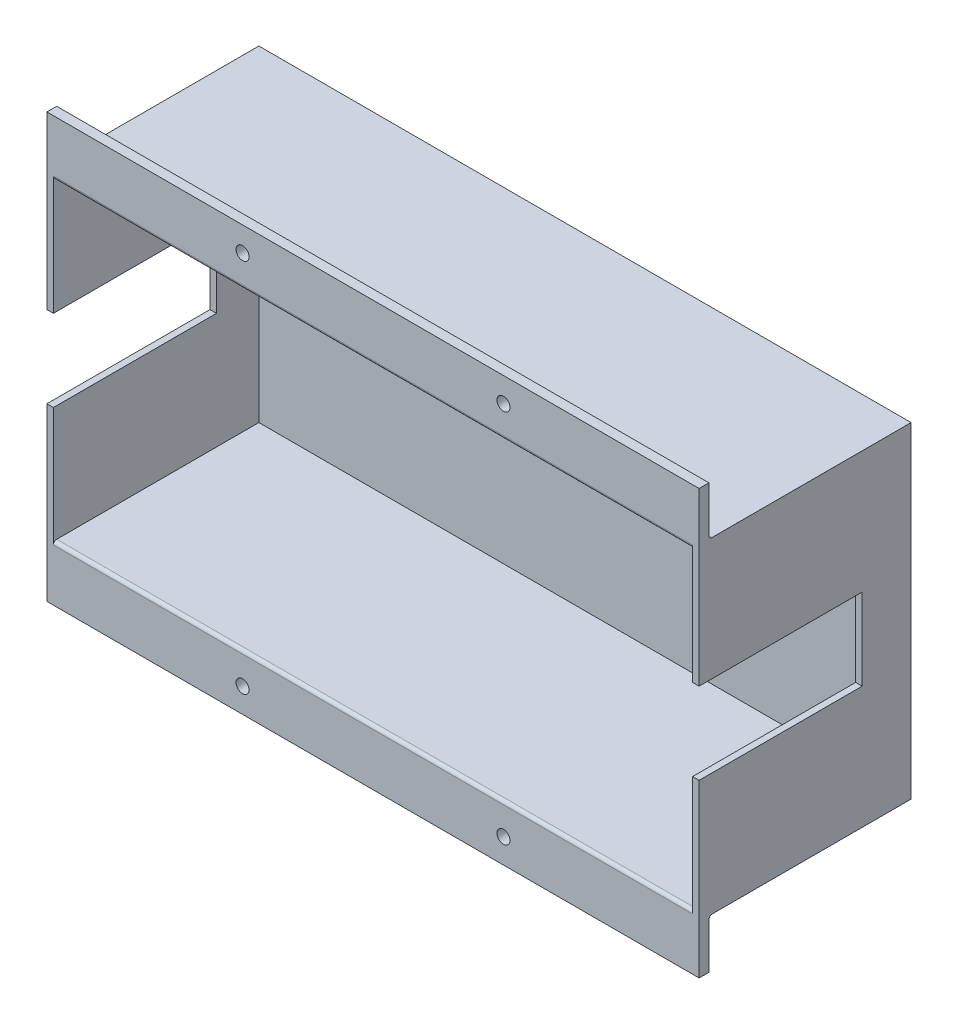
from build123d import *

# Parameters (mm, degrees)
SKETCH_1_W             = 200
SKETCH_1_H             = 100
EXTRUDE_1_DEPTH        = 2
SKETCH_2_W             = 200
SKETCH_2_H             = 100
SKETCH_2_W_2           = 196
SKETCH_2_H_2           = 96
EXTRUDE_2_DEPTH        = 63
SKETCH_3_W             = 7
SKETCH_3_H             = 18
CUT_EXTRUDE_1_DEPTH    = 63
SKETCH_4_W             = 200
SKETCH_4_H             = 15
EXTRUDE_3_DEPTH        = 3
EXTRUDE_4_DEPTH        = 5
PATTERN_LINEAR_1_COUNT = 2
PATTERN_LINEAR_1_PITCH = 80
PATTERN_LINEAR_2_COUNT = 2
PATTERN_LINEAR_2_PITCH = 80
SKETCH_6_R             = 2
CUT_EXTRUDE_2_DEPTH    = 5
FILLET_1_R             = 1
SKETCH_7_W             = 50
SKETCH_7_H             = 25
CUT_EXTRUDE_3_DEPTH    = 281


with BuildPart() as part:
    # 草图1 → 凸台-拉伸1 (new body)
    with BuildSketch(Plane.XY):
        Rectangle(SKETCH_1_W, SKETCH_1_H)
    extrude(amount=EXTRUDE_1_DEPTH)

    # 草图2 → 凸台-拉伸2 (add)
    with BuildSketch(Plane.XY.offset(2)):
        Rectangle(SKETCH_2_W, SKETCH_2_H)
        Rectangle(SKETCH_2_W_2, SKETCH_2_H_2, mode=Mode.SUBTRACT)
    extrude(amount=EXTRUDE_2_DEPTH)

    # 草图3 → 切除-拉伸1 (cut)
    with BuildSketch(Plane(origin=(0, 0, 0), x_dir=(-1, 0, 0), z_dir=(0, 0, -1))):
        with Locations((12.5, 0)):
            Rectangle(SKETCH_3_W, SKETCH_3_H)
        with Locations((-12.5, 0)):
            Rectangle(SKETCH_3_W, SKETCH_3_H)
    extrude(amount=-CUT_EXTRUDE_1_DEPTH, mode=Mode.SUBTRACT)

    # 草图4 → 凸台-拉伸3 (add)
    with BuildSketch(Plane.XY.offset(65)):
        with Locations((0, 57.5)):
            Rectangle(SKETCH_4_W, SKETCH_4_H)
        with Locations((0, -57.5)):
            Rectangle(SKETCH_4_W, SKETCH_4_H)
    extrude(amount=-EXTRUDE_3_DEPTH)

    # 草图5 → 凸台-拉伸4 (add)
    with BuildSketch(Plane(origin=(0, 0, 0), x_dir=(0, 0, -1), z_dir=(1, 0, 0))):
        Polygon((-62, 60), (-52, 50), (-62, 50), align=None)
        Polygon((-52, -50), (-62, -50), (-62, -60), align=None)
    extrude_4 = extrude(amount=EXTRUDE_4_DEPTH)

    # 阵列(线性)1: 凸台-拉伸4 ×2
    with Locations(*[(-i * PATTERN_LINEAR_1_PITCH, 0, 0) for i in range(1, PATTERN_LINEAR_1_COUNT)]):
        add(extrude_4)

    # 阵列(线性)2: 凸台-拉伸4 ×2
    with Locations(*[(i * PATTERN_LINEAR_2_PITCH, 0, 0) for i in range(1, PATTERN_LINEAR_2_COUNT)]):
        add(extrude_4)

    # 草图6 → 切除-拉伸2 (cut)
    with BuildSketch(Plane(origin=(0, 0, 62), x_dir=(-1, 0, 0), z_dir=(0, 0, -1))):
        with Locations((-40, -57.5)):
            Circle(SKETCH_6_R)
        with Locations(Location((40, -57.5, 0), (0, 0, 180))):
            Circle(SKETCH_6_R)
        with Locations((40, 57.5)):
            Circle(SKETCH_6_R)
        with Locations(Location((-40, 57.5, 0), (0, 0, 180))):
            Circle(SKETCH_6_R)
    extrude(amount=-CUT_EXTRUDE_2_DEPTH, mode=Mode.SUBTRACT)

    # 圆角1
    fillet_1_edges = [part.edges().sort_by_distance(p)[0] for p in [
        (42.5, 50, 62),
        (-37.5, -50, 62),
        (-37.5, 50, 62),
        (92.5, 50, 62),
        (42.5, -50, 62),
        (0, 48, 65),
        (0, -48, 65),
        (92.5, -50, 62),
    ]]
    fillet(fillet_1_edges, radius=FILLET_1_R)

    # 草图7 → 切除-拉伸3 (cut)
    with BuildSketch(Plane(origin=(100, 0, 0), x_dir=(0, 0, -1), z_dir=(1, 0, 0))):
        with Locations((-40, 0)):
            Rectangle(SKETCH_7_W, SKETCH_7_H)
    extrude(amount=-CUT_EXTRUDE_3_DEPTH, mode=Mode.SUBTRACT)


solid = part.part
